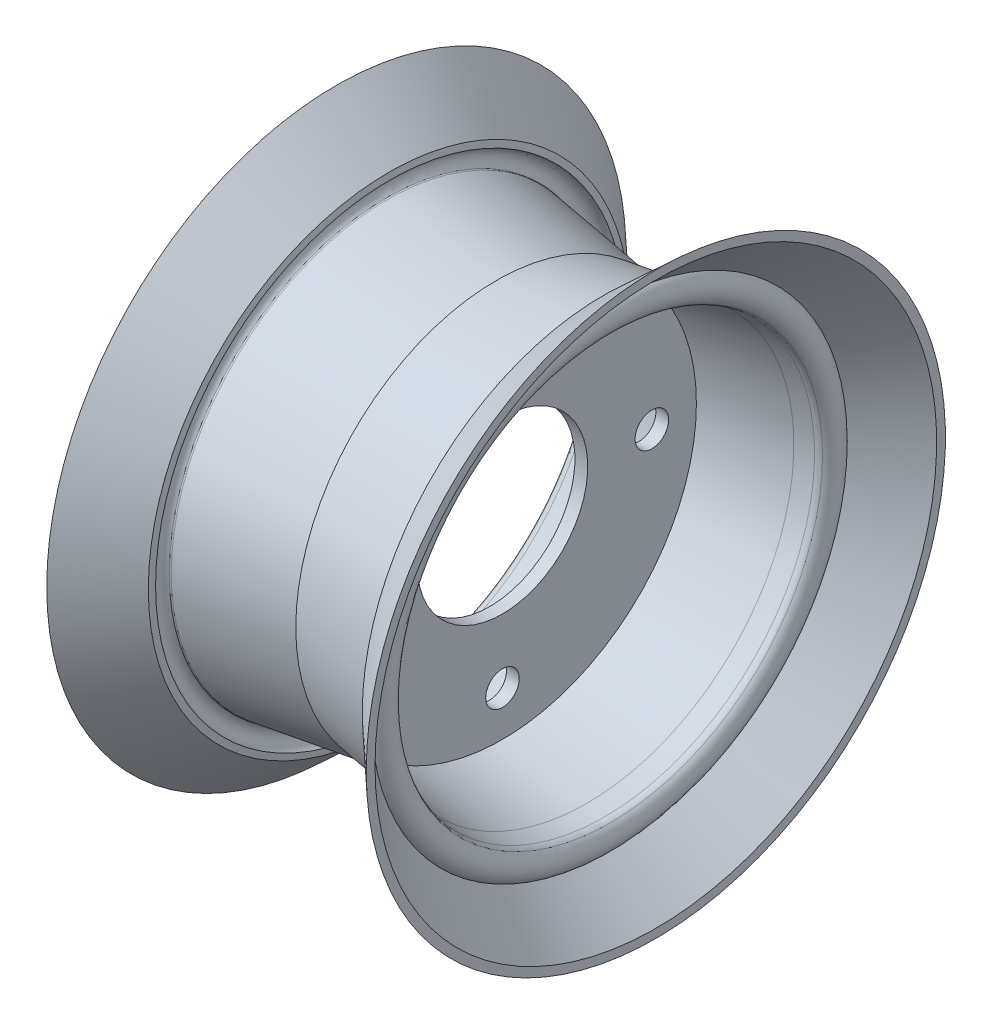
from build123d import *

# Parameters (mm, degrees)
SKETCH3_R          = 3.937
CUT_EXTRUDE1_DEPTH = 1.5


with BuildPart() as part:
    # Sketch1 → Revolve1 (revolve)
    with BuildSketch(Plane.XY, mode=Mode.PRIVATE) as revolve1_sk:
        with BuildLine():
            Line((21.299764248, 48.577440853), (1.5, 45.5))
            Line((1.5, 45.5), (1.5, 20))
            Line((1.5, 20), (0, 20))
            Line((0, 20), (0, 47))
            Line((0, 47), (25.472402047, 50.75))
            ThreePointArc((25.472402047, 50.75), (25.65369453, 50.78402464), (25.810313366, 50.881467857))
            ThreePointArc((25.810313366, 50.881467857), (26.542232857, 53.204287978), (24.897052689, 55))
            Line((24.897052689, 55), (25.1, 56.5))
            Line((25.1, 56.5), (37.484336202, 67.949723582))
            Line((37.484336202, 67.949723582), (37.484336202, 65.891748813))
            Line((37.484336202, 65.891748813), (26.53810168, 55.816305433))
            ThreePointArc((26.53810168, 55.816305433), (28.095597256, 52.863049947), (26.824047324, 49.775871429))
            ThreePointArc((26.824047324, 49.775871429), (26.197571978, 49.386098562), (25.472402047, 49.25))
            Line((25.472402047, 49.25), (21.299764248, 48.577440853))
        make_face()
    revolve1 = revolve(revolve1_sk.sketch.rotate(Axis((-124.142501928, 0, 0), (1, 0, 0)), 90), axis=Axis((-124.142501928, 0, 0), (1, 0, 0)))

    # Sketch3 → Cut-Extrude1 (cut)
    with BuildSketch(Plane(origin=(0, 0, 0), x_dir=(0, 0, -1), z_dir=(1, 0, 0))):
        with Locations(Location((0, 35.052, 0), (0, 0, 180))):
            Circle(SKETCH3_R)
        with Locations(Location((35.052, 0, 0), (0, 0, 180))):
            Circle(SKETCH3_R)
        with Locations(Location((0, -35.052, 0), (0, 0, 180))):
            Circle(SKETCH3_R)
        with Locations(Location((-35.052, 0, 0), (0, 0, 180))):
            Circle(SKETCH3_R)
    cut_extrude1 = extrude(amount=CUT_EXTRUDE1_DEPTH, mode=Mode.SUBTRACT)

    # Mirror1: Revolve1, Cut-Extrude1 across plane
    add(revolve1.mirror(Plane(origin=(0, 47, 0), x_dir=(0, 0, 1), z_dir=(1, 0, 0))))
    add(cut_extrude1.mirror(Plane(origin=(0, 47, 0), x_dir=(0, 0, 1), z_dir=(1, 0, 0))), mode=Mode.SUBTRACT)


solid = part.part
